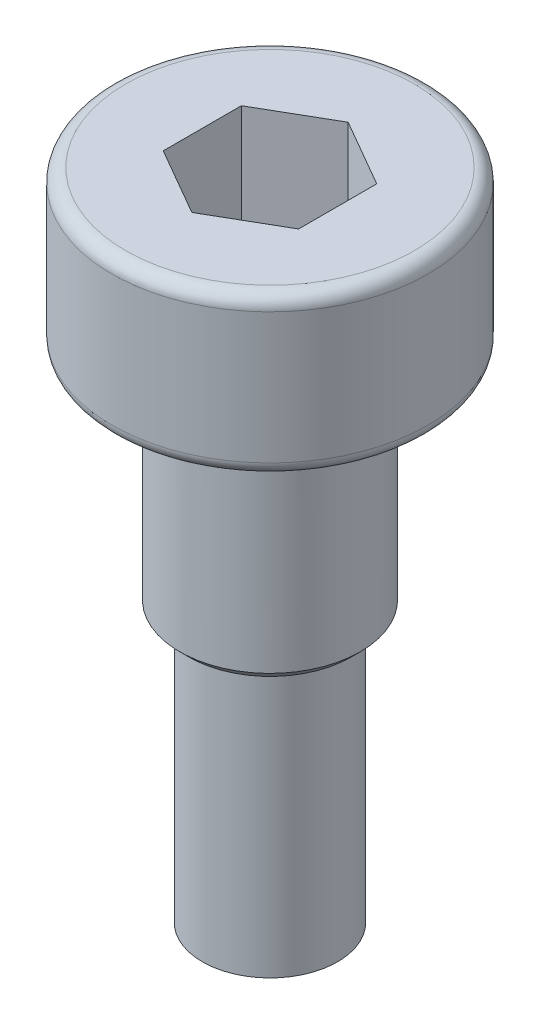
from build123d import *

# Parameters (mm, degrees)
FILLET_1_R          = 0.3
CUT_EXTRUDE_1_DEPTH = 2.4
CHAMFER_1_SIZE      = 0.2


with BuildPart() as part:
    # 草图1 → 旋转1 (revolve)
    with BuildSketch(Plane.XY):
        Polygon((0, 3.5), (-3.5, 3.5), (-3.5, 0), (-2, 0), (-2, -5), (-1.5, -5), (-1.5, -11), (0, -11), align=None)
    revolve(axis=Axis((0, 3.5, 0), (0, -1, 0)))

    # 圆角1
    fillet_1_edges = [part.edges().sort_by_distance(p)[0] for p in [
        (3.5, 0, 0),
        (3.5, 3.5, 0),
    ]]
    fillet(fillet_1_edges, radius=FILLET_1_R)

    # 草图2 → 切除-拉伸1 (cut)
    with BuildSketch(Plane(origin=(0, 3.5, 0), x_dir=(1, 0, 0), z_dir=(0, 1, 0))):
        Polygon((0, 1.732050808), (-1.5, 0.866025404), (-1.5, -0.866025404), (0, -1.732050808), (1.5, -0.866025404), (1.5, 0.866025404), align=None)
    extrude(amount=-CUT_EXTRUDE_1_DEPTH, mode=Mode.SUBTRACT)

    # 倒角1
    chamfer_1_edges = [part.edges().sort_by_distance(p)[0] for p in [
        (2, -5, 0),
    ]]
    chamfer(chamfer_1_edges, length=CHAMFER_1_SIZE)


solid = part.part
